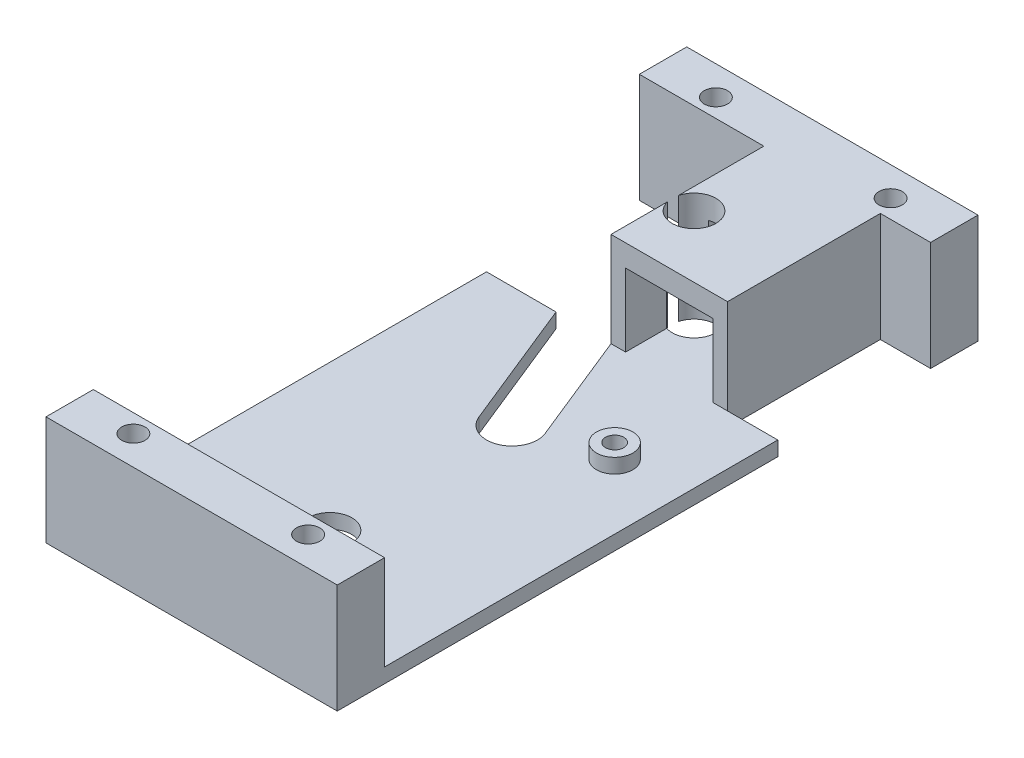
from build123d import *

# Parameters (mm, degrees)
CROQUIS1_W              = 40
CROQUIS1_H              = 88
CROQUIS1_R              = 1.6
SALIENTE_EXTRUIR1_DEPTH = 15
CORTAR_EXTRUIR1_DEPTH   = 13
CROQUIS3_R              = 2.5
SALIENTE_EXTRUIR3_DEPTH = 2
CROQUIS4_R              = 1.25
CORTAR_EXTRUIR2_DEPTH   = 50.568134926
CROQUIS5_W              = 17.1
CROQUIS5_H              = 20.988594156
CROQUIS5_W_2            = 6.9
CORTAR_EXTRUIR3_DEPTH   = 51.606323716
SALIENTE_EXTRUIR4_START = -3
SALIENTE_EXTRUIR4_DEPTH = 3
CORTAR_EXTRUIR4_DEPTH   = 1
CROQUIS8_R              = 3
CORTAR_EXTRUIR5_DEPTH   = 51.606323716


with BuildPart() as part:
    # Croquis1 → Saliente-Extruir1 (new body)
    with BuildSketch(Plane(origin=(0, 0, 0), x_dir=(1, 0, 0), z_dir=(0, 1, 0))):
        Rectangle(CROQUIS1_W, CROQUIS1_H)
        with Locations(Location((-12, 40, 0), (0, 0, 270))):
            Circle(CROQUIS1_R, mode=Mode.SUBTRACT)
        with Locations(Location((12, 40, 0), (0, 0, 90))):
            Circle(CROQUIS1_R, mode=Mode.SUBTRACT)
        with Locations(Location((-12, -40, 0), (0, 0, 90))):
            Circle(CROQUIS1_R, mode=Mode.SUBTRACT)
        with Locations(Location((12, -40, 0), (0, 0, 270))):
            Circle(CROQUIS1_R, mode=Mode.SUBTRACT)
    extrude(amount=SALIENTE_EXTRUIR1_DEPTH)

    # Croquis2 → Cortar-Extruir1 (cut)
    with BuildSketch(Plane(origin=(0, 15, 0), x_dir=(1, 0, 0), z_dir=(0, 1, 0))):
        Polygon((-0.9, 48.396555715), (11.1, 48.396555715), (11.1, 16.5), (20, 16.5), (20, -37.5), (-20, -37.5), (-20, 16.5), (-0.9, 16.5), align=None)
    extrude(amount=-CORTAR_EXTRUIR1_DEPTH, mode=Mode.SUBTRACT)

    # Croquis3 → Saliente-Extruir3 (add)
    with BuildSketch(Plane(origin=(0, 2, 0), x_dir=(1, 0, 0), z_dir=(0, 1, 0))):
        with Locations(Location((11.1, 3, 0), (0, 0, 270))):
            Circle(CROQUIS3_R)
        with Locations(Location((4.1, -34.5, 0), (0, 0, 270))):
            Circle(CROQUIS3_R)
    extrude(amount=SALIENTE_EXTRUIR3_DEPTH)

    # Croquis4 → Cortar-Extruir2 (cut, through all)
    with BuildSketch(Plane(origin=(0, 4, 0), x_dir=(1, 0, 0), z_dir=(0, 1, 0))):
        with Locations(Location((11.1, 3, 0), (0, 0, 270))):
            Circle(CROQUIS4_R)
        with Locations(Location((4.1, -34.5, 0), (0, 0, 270))):
            Circle(CROQUIS4_R)
    extrude(amount=-CORTAR_EXTRUIR2_DEPTH, mode=Mode.SUBTRACT)

    # Croquis5 → Cortar-Extruir3 (cut, through all)
    with BuildSketch(Plane(origin=(0, 15, 0), x_dir=(1, 0, 0), z_dir=(0, 1, 0))):
        with Locations((-11.45, 26.994297078)):
            Rectangle(CROQUIS5_W, CROQUIS5_H)
        with Locations((16.55, 26.994297078)):
            Rectangle(CROQUIS5_W_2, CROQUIS5_H)
    extrude(amount=-CORTAR_EXTRUIR3_DEPTH, mode=Mode.SUBTRACT)

    # Croquis6 → Saliente-Extruir4 (add)
    with BuildSketch(Plane(origin=(0, 15, 0), x_dir=(1, 0, 0), z_dir=(0, 1, 0)).offset(SALIENTE_EXTRUIR4_START)):
        with BuildLine():
            Line((11.1, 44), (11.1, 41.322875656))
            ThreePointArc((11.1, 41.322875656), (10.4, 40), (11.1, 38.677124344))
            Line((11.1, 38.677124344), (11.1, 16.5))
            Line((11.1, 16.5), (-0.9, 16.5))
            Line((-0.9, 16.5), (-0.9, 44))
            Line((-0.9, 44), (11.1, 44))
        make_face()
    extrude(amount=SALIENTE_EXTRUIR4_DEPTH)

    # Croquis7 → Cortar-Extruir4 (cut)
    with BuildSketch(Plane(origin=(0, 0, -44), x_dir=(-1, 0, 0), z_dir=(0, 0, -1))):
        Polygon((-18.385000464, 9.353074792), (-13.054807804, 9.353074792), (-13.054807804, 8.645158579), (-13.596155496, 7.812315976), (-17.843652772, 7.812315976), (-18.385000464, 8.645158579), align=None)
    extrude(amount=-CORTAR_EXTRUIR4_DEPTH, mode=Mode.SUBTRACT)

    # Croquis8 → Cortar-Extruir5 (cut, through all)
    with BuildSketch(Plane.XZ):
        with Locations(Location((0, 25, 0), (0, 0, 270))):
            Circle(CROQUIS8_R)
        with Locations((0, -25)):
            Circle(CROQUIS8_R)
        with BuildLine():
            Line((-2.9, -16.5), (3.244083024, -1.312379042))
            ThreePointArc((3.244083024, -1.312379042), (1.312379042, 3.244083024), (-3.244083024, 1.312379042))
            Line((-3.244083024, 1.312379042), (-10.45, -16.5))
            Line((-10.45, -16.5), (-2.9, -16.5))
        make_face()
    extrude(amount=-CORTAR_EXTRUIR5_DEPTH, mode=Mode.SUBTRACT)


solid = part.part
